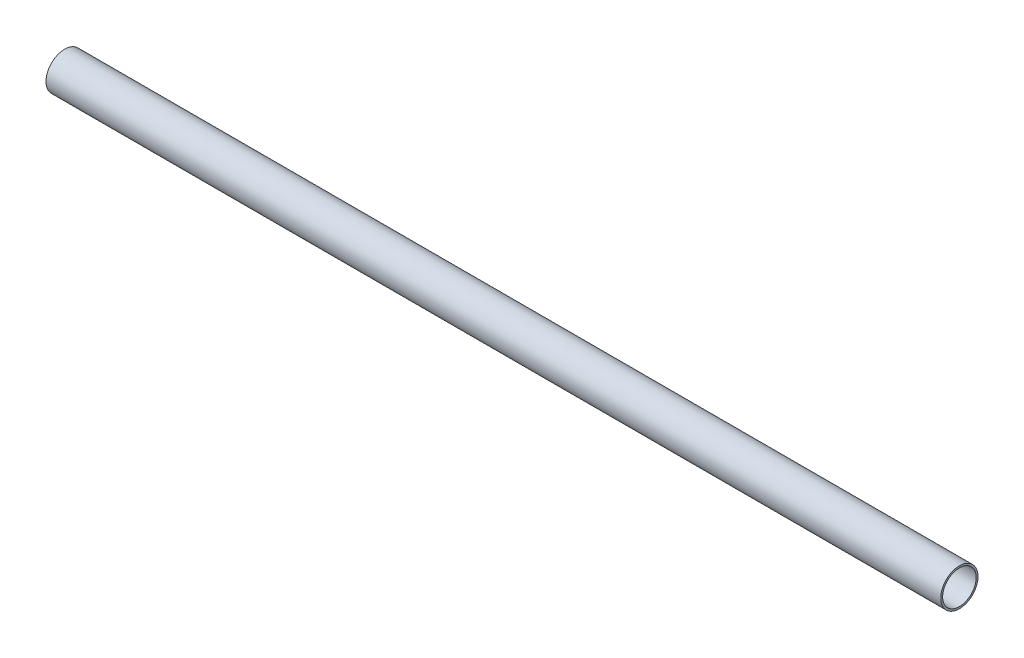
from build123d import *

# Parameters (mm, degrees)
SKETCH1_R               = 12.7
BOSS_EXTRUDE1_DEPTH     = 609.6
CUT_EXTRUDE1_DEPTH      = 610.86452594
CUT_EXTRUDE1_DEPTH_BACK = 610.86452594
SKETCH2_R               = 11.43


with BuildPart() as part:
    # Sketch1 → Boss-Extrude1 (new body)
    with BuildSketch(Plane(origin=(0, 0, 0), x_dir=(0, 0, -1), z_dir=(1, 0, 0))):
        with Locations(Location((0, 0, 0), (0, 0, 180))):
            Circle(SKETCH1_R)
    extrude(amount=BOSS_EXTRUDE1_DEPTH)

    # Sketch2 → Cut-Extrude1 (cut, two sides: drawn at the far end of the back side and taken through both)
    with BuildSketch(Plane(origin=(609.6, 0, 0), x_dir=(0, 0, -1), z_dir=(1, 0, 0)).offset(-CUT_EXTRUDE1_DEPTH_BACK)):
        Circle(SKETCH2_R)
    extrude(amount=CUT_EXTRUDE1_DEPTH + CUT_EXTRUDE1_DEPTH_BACK, mode=Mode.SUBTRACT)


solid = part.part
